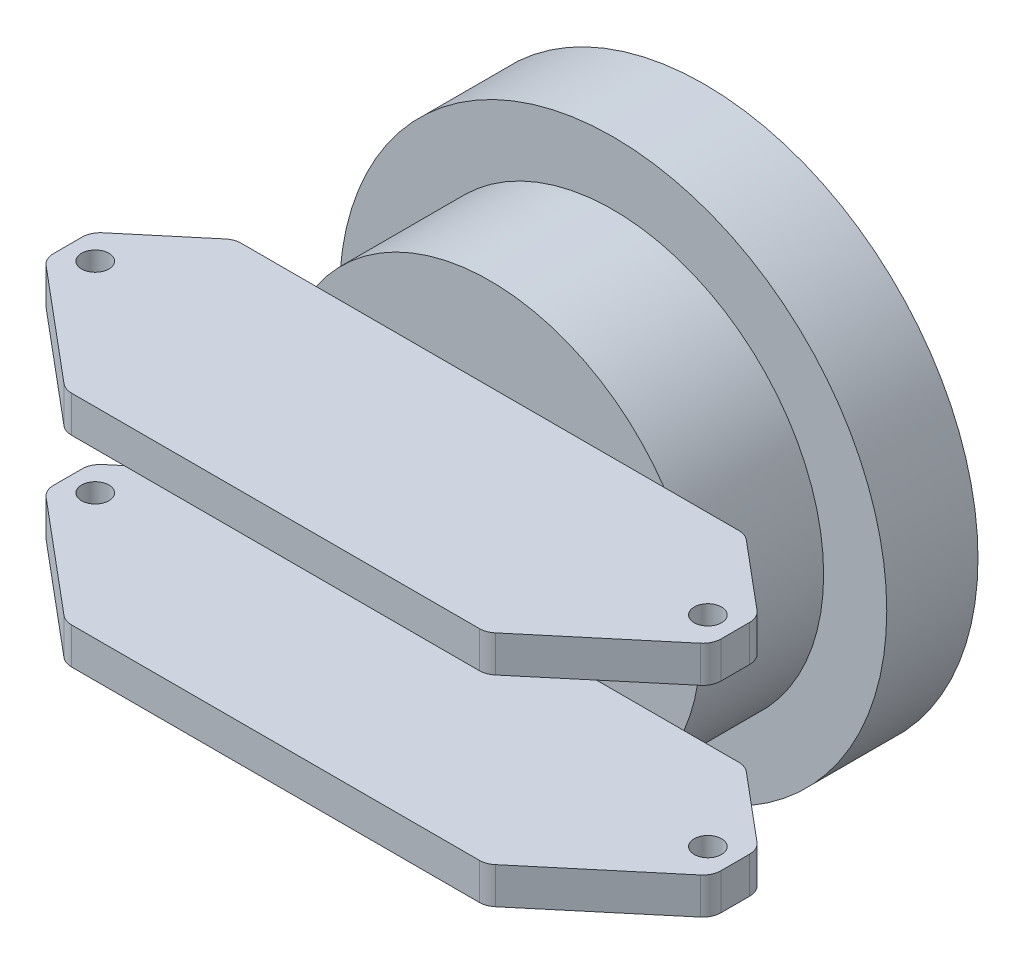
from build123d import *

# Parameters (mm, degrees)
SKETCH1_R               = 30
BOSS_EXTRUDE1_DEPTH     = 10
SKETCH2_R               = 23.08
BOSS_EXTRUDE2_DEPTH     = 13.486192569
BOSS_EXTRUDE3_DEPTH     = 4
FILLET1_R               = 2
SKETCH5_R               = 1.5
CUT_EXTRUDE1_DEPTH      = 4
MIRROR2_COPY_1_SKETCH_R = 1.5
MIRROR2_COPY_1_DEPTH    = 4
FILLET1_OF_MIRROR2_R    = 2
SKETCH8_R               = 7.5
CUT_EXTRUDE2_DEPTH      = 10


with BuildPart() as part:
    # Sketch1 → Boss-Extrude1 (new body)
    with BuildSketch(Plane.XY):
        Circle(SKETCH1_R)
    extrude(amount=BOSS_EXTRUDE1_DEPTH)

    # Sketch2 → Boss-Extrude2 (add)
    with BuildSketch(Plane.XY.offset(10)):
        Circle(SKETCH2_R)
    extrude(amount=BOSS_EXTRUDE2_DEPTH)

    # Sketch4 → Boss-Extrude3 (add)
    with BuildSketch(Plane(origin=(0, 13, 0), x_dir=(1, 0, 0), z_dir=(0, 1, 0))):
        Polygon((28, -23.486192569), (-28, -23.486192569), (-36.579697763, -30.685413797), (-36.579697763, -35.685413797), (-23.08, -47.013005211), (23.08, -47.013005211), (36.579697763, -35.685413797), (36.579697763, -30.685413797), align=None)
    boss_extrude3 = extrude(amount=-BOSS_EXTRUDE3_DEPTH)

    # Fillet1
    fillet1_edges = [part.edges().sort_by_distance(p)[0] for p in [
        (-36.579697763, 11, 30.685413797),
        (-28, 11, 23.486192569),
        (28, 11, 23.486192569),
        (36.579697763, 11, 30.685413797),
        (36.579697763, 11, 35.685413797),
        (23.08, 11, 47.013005211),
        (-23.08, 11, 47.013005211),
        (-36.579697763, 11, 35.685413797),
    ]]
    fillet(fillet1_edges, radius=FILLET1_R)

    # Sketch5 → Cut-Extrude1 (cut)
    with BuildSketch(Plane(origin=(0, 13, 0), x_dir=(1, 0, 0), z_dir=(0, 1, 0))):
        with Locations(Location((-33.579697763, -33.185413797, 0), (0, 0, 270))):
            Circle(SKETCH5_R)
    cut_extrude1 = extrude(amount=-CUT_EXTRUDE1_DEPTH, mode=Mode.SUBTRACT)

    # Mirror1: Cut-Extrude1 across plane
    add(cut_extrude1.mirror(Plane(origin=(0, 0, 0), x_dir=(0, 0, 1), z_dir=(1, 0, 0))), mode=Mode.SUBTRACT)

    # Mirror2: Boss-Extrude3, Cut-Extrude1 across plane
    add(boss_extrude3.mirror(Plane.ZX))
    add(cut_extrude1.mirror(Plane.ZX), mode=Mode.SUBTRACT)

    # Mirror2 copy 1 sketch → Mirror2 copy 1 (cut)
    with BuildSketch(Plane(origin=(0, -13, 0), x_dir=(-1, 0, 0), z_dir=(0, -1, 0))):
        with Locations(Location((-33.579697763, -33.185413797, 0), (0, 0, 270))):
            Circle(MIRROR2_COPY_1_SKETCH_R)
    extrude(amount=-MIRROR2_COPY_1_DEPTH, mode=Mode.SUBTRACT)

    # Fillet1 of Mirror2
    fillet1_of_mirror2_edges = [part.edges().sort_by_distance(p)[0] for p in [
        (-36.579697763, -11, 30.685413797),
        (-28, -11, 23.486192569),
        (28, -11, 23.486192569),
        (36.579697763, -11, 30.685413797),
        (36.579697763, -11, 35.685413797),
        (23.08, -11, 47.013005211),
        (-23.08, -11, 47.013005211),
        (-36.579697763, -11, 35.685413797),
    ]]
    fillet(fillet1_of_mirror2_edges, radius=FILLET1_OF_MIRROR2_R)

    # Sketch8 → Cut-Extrude2 (cut)
    with BuildSketch(Plane(origin=(0, 0, 0), x_dir=(-1, 0, 0), z_dir=(0, 0, -1))):
        Circle(SKETCH8_R)
    extrude(amount=-CUT_EXTRUDE2_DEPTH, mode=Mode.SUBTRACT)


solid = part.part
